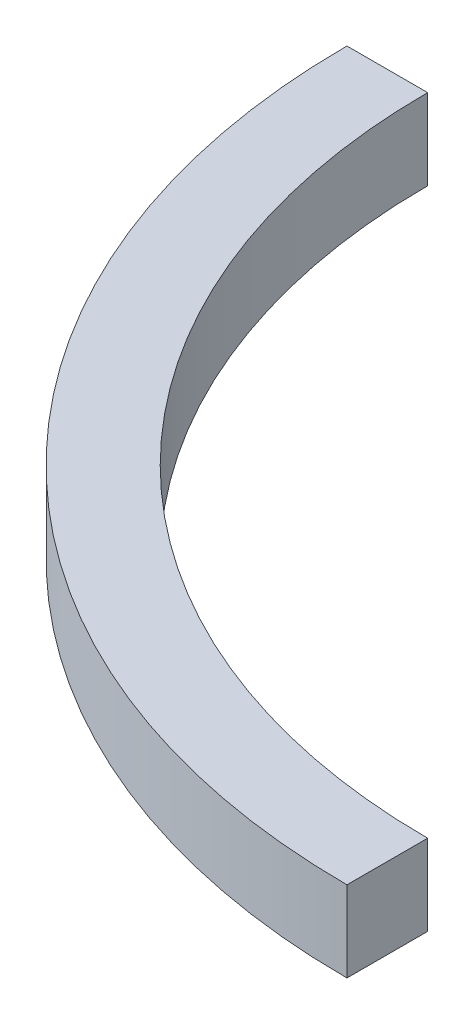
from build123d import *

# Parameters (mm, degrees)
EXTRUDE_1_DEPTH = 3


with BuildPart() as part:
    # 草圖1 → 填料-伸長1 (new body)
    with BuildSketch(Plane(origin=(0, 0, 0), x_dir=(1, 0, 0), z_dir=(0, 1, 0))):
        with BuildLine():
            Line((-27, 0), (-24, 0))
            ThreePointArc((-24, 0), (-16.970562748, -16.970562748), (0, -24))
            Line((0, -24), (0, -27))
            ThreePointArc((0, -27), (-19.091883092, -19.091883092), (-27, 0))
        make_face()
    extrude(amount=EXTRUDE_1_DEPTH)


solid = part.part
